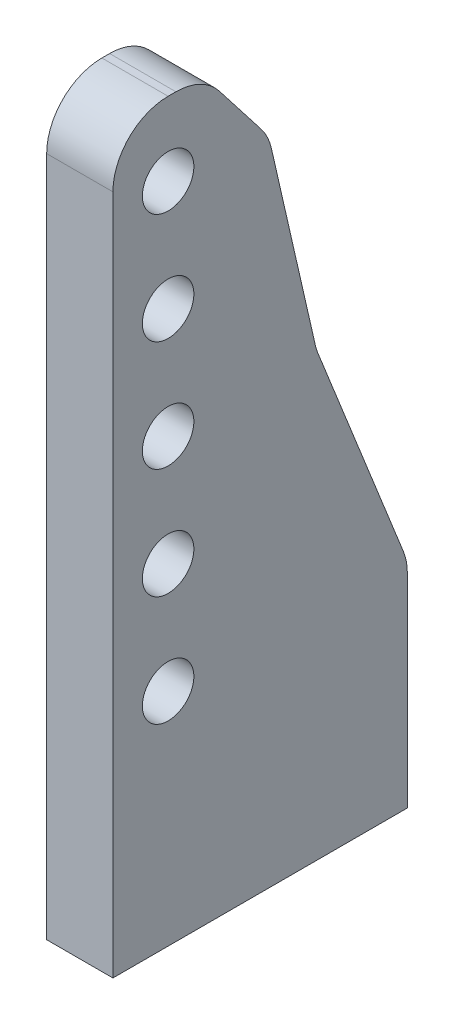
from build123d import *

# Parameters (mm, degrees)
SKETCH_1_W          = 1.8
SKETCH_1_H          = 8
EXTRUDE_1_DEPTH     = 20
SKETCH_3_R          = 0.7
CUT_EXTRUDE_1_DEPTH = 20
FILLET_1_R          = 1.5


with BuildPart() as part:
    # 草圖1 → 填料-伸長1 (new body)
    with BuildSketch(Plane(origin=(0, 0, 0), x_dir=(1, 0, 0), z_dir=(0, 1, 0))):
        Rectangle(SKETCH_1_W, SKETCH_1_H)
    extrude(amount=EXTRUDE_1_DEPTH)

    # 草圖3 → 除料-伸長1 (cut)
    with BuildSketch(Plane(origin=(0.9, 0, 0), x_dir=(0, 0, -1), z_dir=(1, 0, 0))):
        with Locations((-2.5, 18)):
            Circle(SKETCH_3_R)
        with Locations((-2.5, 15)):
            Circle(SKETCH_3_R)
        with Locations((-2.5, 12)):
            Circle(SKETCH_3_R)
        with Locations((-2.5, 9)):
            Circle(SKETCH_3_R)
        with Locations((-2.5, 6)):
            Circle(SKETCH_3_R)
        Polygon((-1.554314994, 20), (0.230558493, 17.700704895), (1.525082121, 12.032260524), (4, 5.822351238), (4, 20), align=None)
    extrude(amount=-CUT_EXTRUDE_1_DEPTH, mode=Mode.SUBTRACT)

    # 圓角1
    fillet_1_edges = [part.edges().sort_by_distance(p)[0] for p in [
        (0, 20, 1.554314994),
        (0, 12.032260524, -1.525082121),
        (0, 5.822351238, -4),
        (0, 17.700704895, -0.230558493),
        (0, 20, 4),
    ]]
    fillet(fillet_1_edges, radius=FILLET_1_R)


solid = part.part
